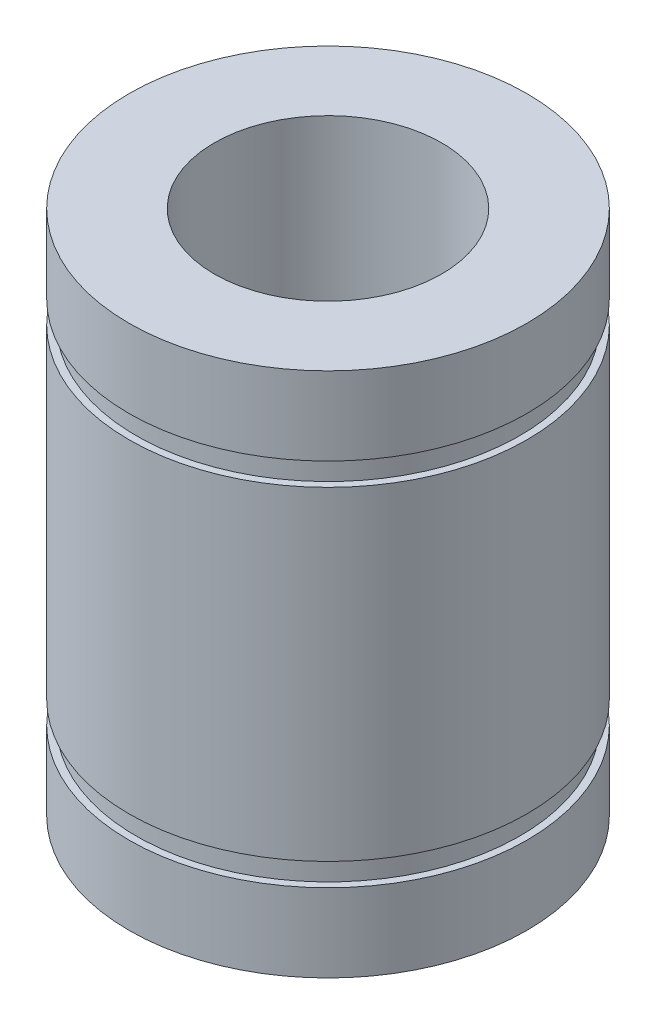
from build123d import *

# Parameters (mm, degrees)
SKETCH_3_R          = 8
CUT_EXTRUDE_1_DEPTH = 37


with BuildPart() as part:
    # Эскиз2 → Повернуть1 (revolve)
    with BuildSketch(Plane.XY, mode=Mode.PRIVATE) as revolve_1_sk:
        Polygon((13.5, 5.5), (14, 5.5), (14, 0), (0, 0), (0, 37), (14, 37), (14, 31.5), (13.5, 31.5), (13.5, 29.9), (14, 29.9), (14, 7.1), (13.5, 7.1), align=None)
    revolve(revolve_1_sk.sketch.rotate(Axis((0, 0, 0), (0, 1, 0)), 90), axis=Axis((0, 0, 0), (0, 1, 0)))

    # Эскиз3 → Вырез-Вытянуть1 (cut)
    with BuildSketch(Plane(origin=(0, 37, 0), x_dir=(1, 0, 0), z_dir=(0, 1, 0))):
        with Locations(Location((0, 0, 0), (0, 0, 270))):
            Circle(SKETCH_3_R)
    extrude(amount=-CUT_EXTRUDE_1_DEPTH, mode=Mode.SUBTRACT)


solid = part.part
